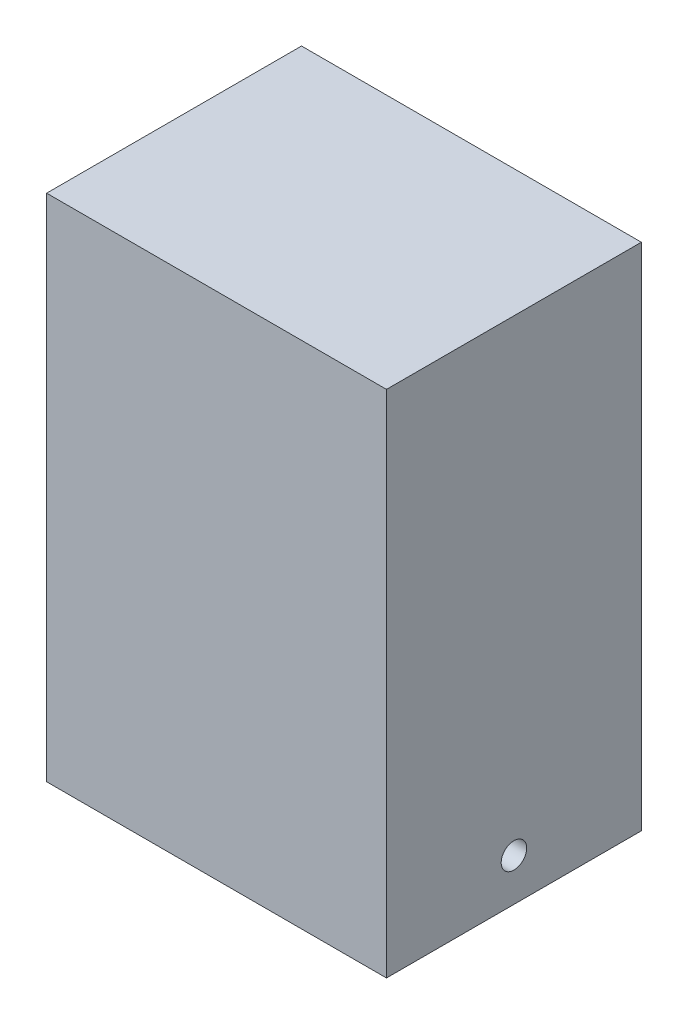
from build123d import *

# Parameters (mm, degrees)
SKETCH1_W           = 40
SKETCH1_H           = 60
BOSS_EXTRUDE1_DEPTH = 30
SKETCH2_R           = 1.5
CUT_EXTRUDE1_DEPTH  = 59.309518948


with BuildPart() as part:
    # Sketch1 → Boss-Extrude1 (new body)
    with BuildSketch(Plane.XY):
        Rectangle(SKETCH1_W, SKETCH1_H)
    extrude(amount=BOSS_EXTRUDE1_DEPTH)

    # Sketch2 → Cut-Extrude1 (cut, through all)
    with BuildSketch(Plane(origin=(20, 0, 0), x_dir=(0, 0, -1), z_dir=(1, 0, 0))):
        with Locations((-15, -25)):
            Circle(SKETCH2_R)
    extrude(amount=-CUT_EXTRUDE1_DEPTH, mode=Mode.SUBTRACT)


solid = part.part
